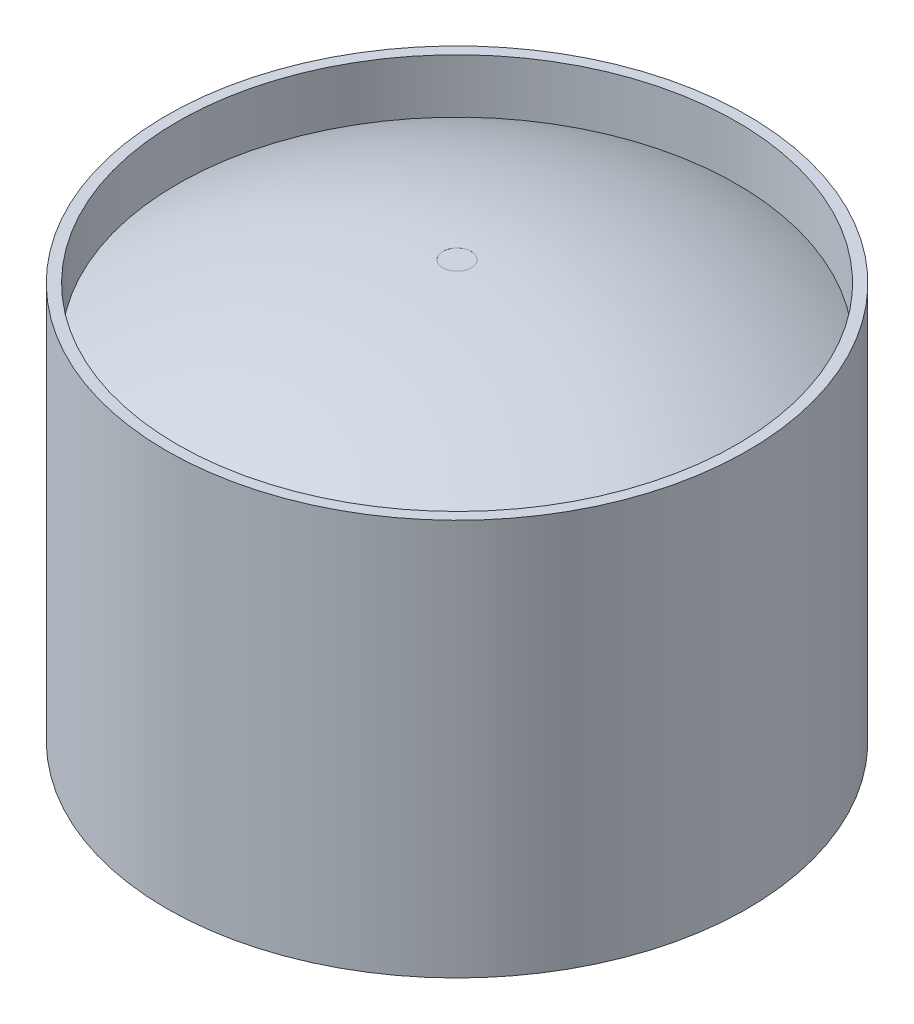
from build123d import *

# Parameters (mm, degrees)
SKETCH1_R                = 4.03065
SKETCH1_R_2              = 3.88065
BOSS_EXTRUDE1_DEPTH      = 5.5
BOSS_EXTRUDE2_DEPTH      = 0.28159739
BOSS_EXTRUDE2_DEPTH_BACK = 5.5
SKETCH3_R                = 0.197408615


with BuildPart() as part:
    # Sketch1 → Boss-Extrude1 (new body)
    with BuildSketch(Plane(origin=(0, 0, 0), x_dir=(1, 0, 0), z_dir=(0, 1, 0))):
        with Locations(Location((0, 0, 0), (0, 0, 270))):
            Circle(SKETCH1_R)
        with Locations(Location((0, 0, 0), (0, 0, 270))):
            Circle(SKETCH1_R_2, mode=Mode.SUBTRACT)
    extrude(amount=BOSS_EXTRUDE1_DEPTH)

    # Sketch2 → Revolve1 (revolve)
    with BuildSketch(Plane.XY, mode=Mode.PRIVATE) as revolve1_sk:
        with BuildLine():
            Line((0.197408615, 0), (0.197408615, 5.781917471))
            ThreePointArc((0.197408615, 5.781917471), (2.106547816, 5.506953748), (3.88065, 4.75))
            Line((3.88065, 4.75), (3.88065, 0.75))
            ThreePointArc((3.88065, 0.75), (2.068627273, 0.229644733), (0.197408615, 0))
        make_face()
    revolve(revolve1_sk.sketch.rotate(Axis((0, 5.5, 0), (0, -1, 0)), 90), axis=Axis((0, 5.5, 0), (0, -1, 0)))

    # Sketch3 → Boss-Extrude2 (add, two sides: drawn at the far end of the back side and taken through both)
    with BuildSketch(Plane(origin=(0, 5.5, 0), x_dir=(1, 0, 0), z_dir=(0, 1, 0)).offset(-BOSS_EXTRUDE2_DEPTH_BACK)):
        with Locations(Location((0, 0, 0), (0, 0, 270))):
            Circle(SKETCH3_R)
    extrude(amount=BOSS_EXTRUDE2_DEPTH + BOSS_EXTRUDE2_DEPTH_BACK)


solid = part.part
